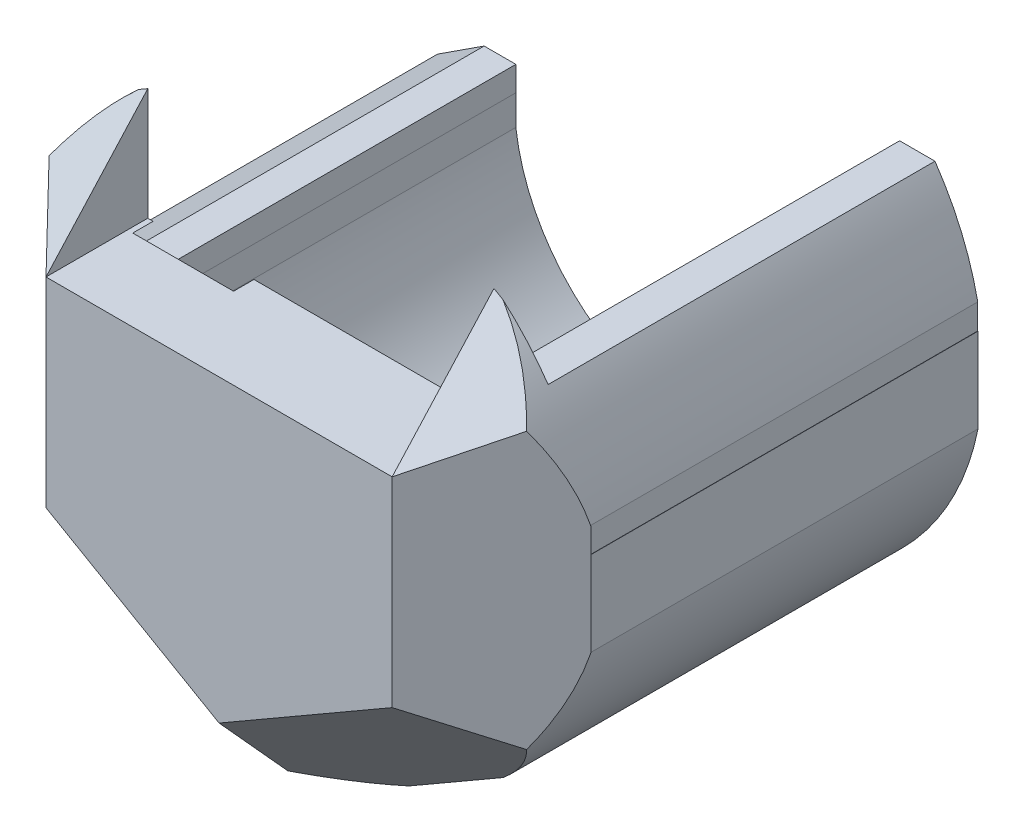
from build123d import *

# Parameters (mm, degrees)
BOSS_EXTRUDE1_DEPTH = 19
CUT_EXTRUDE1_DEPTH  = 5
SKETCH5_R           = 5.5
CUT_EXTRUDE2_DEPTH  = 1
SKETCH6_W           = 3.836976741
SKETCH6_H           = 19
BOSS_EXTRUDE2_DEPTH = 6.17281
CUT_EXTRUDE3_DEPTH  = 19
SKETCH8_R           = 15.326273961
SKETCH8_R_2         = 13.53815969
CUT_EXTRUDE4_DEPTH  = 20
CUT_EXTRUDE5_START  = -20
SKETCH9_R           = 15.315451293
SKETCH9_R_2         = 13.53815969
CUT_EXTRUDE5_DEPTH  = 20


with BuildPart() as part:
    # Sketch1 → Boss-Extrude1 (new body)
    with BuildSketch(Plane.XY):
        with BuildLine():
            Line((9.418070486, 0.286487124), (9.423467442, 1.490329505))
            Line((9.423467442, 1.490329505), (13.272942596, 1.490329505))
            Line((13.272942596, 1.490329505), (13.272942596, -7.663136981))
            Line((13.272942596, -7.663136981), (0, -15.326273961))
            Line((0, -15.326273961), (-13.272942596, -7.663136981))
            Line((-13.272942596, -7.663136981), (-13.272942596, 0))
            Line((-13.272942596, 0), (-10.981676699, 1.490329505))
            Line((-10.981676699, 1.490329505), (-9.423467442, 1.490329505))
            Line((-9.423467442, 1.490329505), (-9.418070486, 0.286487124))
            Line((-9.418070486, 0.286487124), (-9.42470631, -1.19369635))
            ThreePointArc((-9.42470631, -1.19369635), (-0.052384082, -9.499855573), (9.41096903, -1.297559989))
            Line((9.41096903, -1.297559989), (9.418070486, 0.286487124))
        make_face()
    extrude(amount=BOSS_EXTRUDE1_DEPTH)

    # Sketch2 → Loft1 section 0
    with BuildSketch(Plane.XY.offset(19)):
        with BuildLine():
            Line((0, -15.326273961), (13.272942596, -7.663136981))
            Line((13.272942596, -7.663136981), (13.272942596, 7.663136981))
            Line((13.272942596, 7.663136981), (0, 15.326273961))
            Line((0, 15.326273961), (-13.272942596, 7.663136981))
            Line((-13.272942596, 7.663136981), (-13.272942596, -7.663136981))
            Line((-13.272942596, -7.663136981), (0, -15.326273961))
        make_face()
    # Sketch3 → Loft1 section 1
    with BuildSketch(Plane.XY.offset(24)):
        with BuildLine():
            Line((0, -9.814954576), (8.5, -4.907477288))
            Line((8.5, -4.907477288), (8.5, 4.907477288))
            Line((8.5, 4.907477288), (0, 9.814954576))
            Line((0, 9.814954576), (-8.5, 4.907477288))
            Line((-8.5, 4.907477288), (-8.5, -4.907477288))
            Line((-8.5, -4.907477288), (0, -9.814954576))
        make_face()
    loft()

    # Sketch4 → Cut-Extrude1 (cut)
    with BuildSketch(Plane.XY.offset(24)):
        Polygon((-8.5, 4.907477288), (-8.5, 10.418796673), (0, 15.326273961), (8.5, 10.418796673), (8.5, 4.907477288), align=None)
    extrude(amount=-CUT_EXTRUDE1_DEPTH, mode=Mode.SUBTRACT)

    # Sketch5 → Cut-Extrude2 (cut)
    with BuildSketch(Plane(origin=(0, 0, 19), x_dir=(-1, 0, 0), z_dir=(0, 0, -1))):
        with Locations((5.762922136, -0.004092629)):
            Circle(SKETCH5_R)
    extrude(amount=-CUT_EXTRUDE2_DEPTH, mode=Mode.SUBTRACT)

    # Sketch6 → Boss-Extrude2 (add)
    with BuildSketch(Plane(origin=(0, 1.490329505, 0), x_dir=(1, 0, 0), z_dir=(0, 1, 0))):
        with Locations((11.341955813, -9.5)):
            Rectangle(SKETCH6_W, SKETCH6_H)
    extrude(amount=BOSS_EXTRUDE2_DEPTH)

    # Sketch7 → Cut-Extrude3 (cut)
    with BuildSketch(Plane(origin=(0, 0, 0), x_dir=(-1, 0, 0), z_dir=(0, 0, -1))):
        with BuildLine():
            Line((13.53815969, 0), (15.326273961, 0))
            ThreePointArc((15.326273961, 0), (0, -15.326273961), (-15.326273961, 0))
            Line((-15.326273961, 0), (-13.53815969, 0))
            ThreePointArc((-13.53815969, 0), (0, -13.53815969), (13.53815969, 0))
        make_face()
    extrude(amount=-CUT_EXTRUDE3_DEPTH, mode=Mode.SUBTRACT)

    # Sketch8 → Cut-Extrude4 (cut)
    with BuildSketch(Plane(origin=(0, 0, 19), x_dir=(-1, 0, 0), z_dir=(0, 0, -1))):
        Circle(SKETCH8_R)
        Circle(SKETCH8_R_2, mode=Mode.SUBTRACT)
    extrude(amount=-CUT_EXTRUDE4_DEPTH, mode=Mode.SUBTRACT)

    # Sketch9 → Cut-Extrude5 (cut)
    with BuildSketch(Plane.XY.offset(19).offset(CUT_EXTRUDE5_START)):
        Circle(SKETCH9_R)
        Circle(SKETCH9_R_2, mode=Mode.SUBTRACT)
    extrude(amount=CUT_EXTRUDE5_DEPTH, mode=Mode.SUBTRACT)


with BuildPart() as cut_extrude5_kept_piece:
    # of the separate pieces the step leaves, the one the design keeps (cut_extrude5_pieces_kept)
    add(part.part.solids().sort_by_distance((9.41096903, -1.297559989, 0))[0])


solid = cut_extrude5_kept_piece.part
